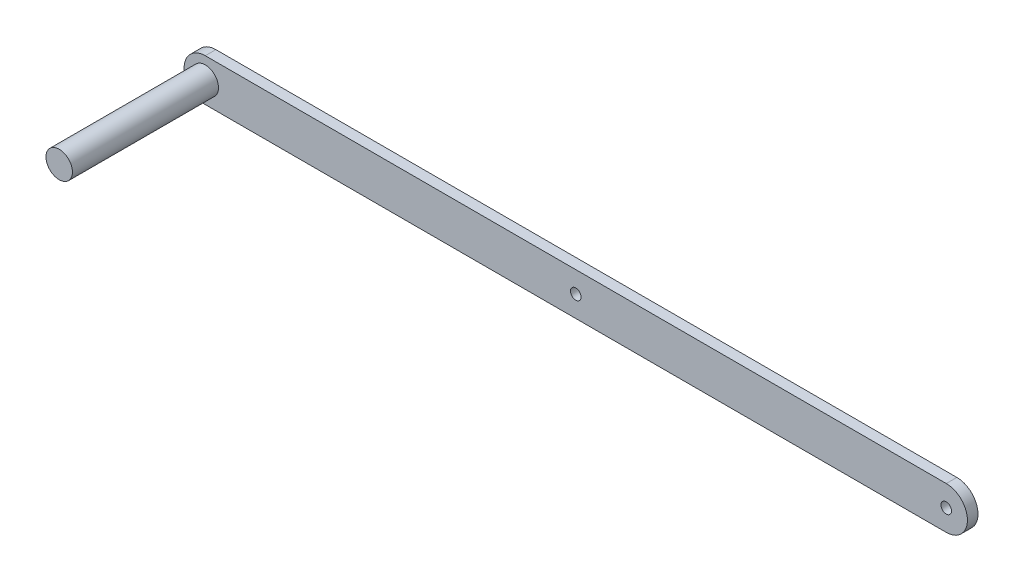
from build123d import *

# Parameters (mm, degrees)
IZIM1_R                     = 5
IZIM1_R_2                   = 12.5
Y_KSEKLIK_EKSTR_ZYON1_DEPTH = 5
IZIM2_R                     = 5
KES_EKSTR_ZYON1_DEPTH       = 15
IZIM1_3_R                   = 12.5
Y_KSEKLIK_EKSTR_ZYON2_DEPTH = 143


with BuildPart() as part:
    # Çizim1 → Yükseklik-Ekstrüzyon1 (new, symmetric)
    with BuildSketch(Plane.XY):
        with BuildLine():
            Line((-350, 20), (350, 20))
            ThreePointArc((350, 20), (370, 0), (350, -20))
            Line((350, -20), (-350, -20))
            ThreePointArc((-350, -20), (-370, 0), (-350, 20))
        make_face()
        with Locations((350, 0)):
            Circle(IZIM1_R, mode=Mode.SUBTRACT)
        with Locations((-350, 0)):
            Circle(IZIM1_R_2, mode=Mode.SUBTRACT)
    extrude(amount=Y_KSEKLIK_EKSTR_ZYON1_DEPTH, both=True)

    # Çizim2 → Kes-Ekstrüzyon1 (cut)
    with BuildSketch(Plane.XY.offset(5)):
        Circle(IZIM2_R)
    extrude(amount=-KES_EKSTR_ZYON1_DEPTH, mode=Mode.SUBTRACT)

    # Çizim1<3> → Yükseklik-Ekstrüzyon2 (add)
    with BuildSketch(Plane.XY):
        with Locations((-350, 0)):
            Circle(IZIM1_3_R)
    extrude(amount=Y_KSEKLIK_EKSTR_ZYON2_DEPTH)


solid = part.part
